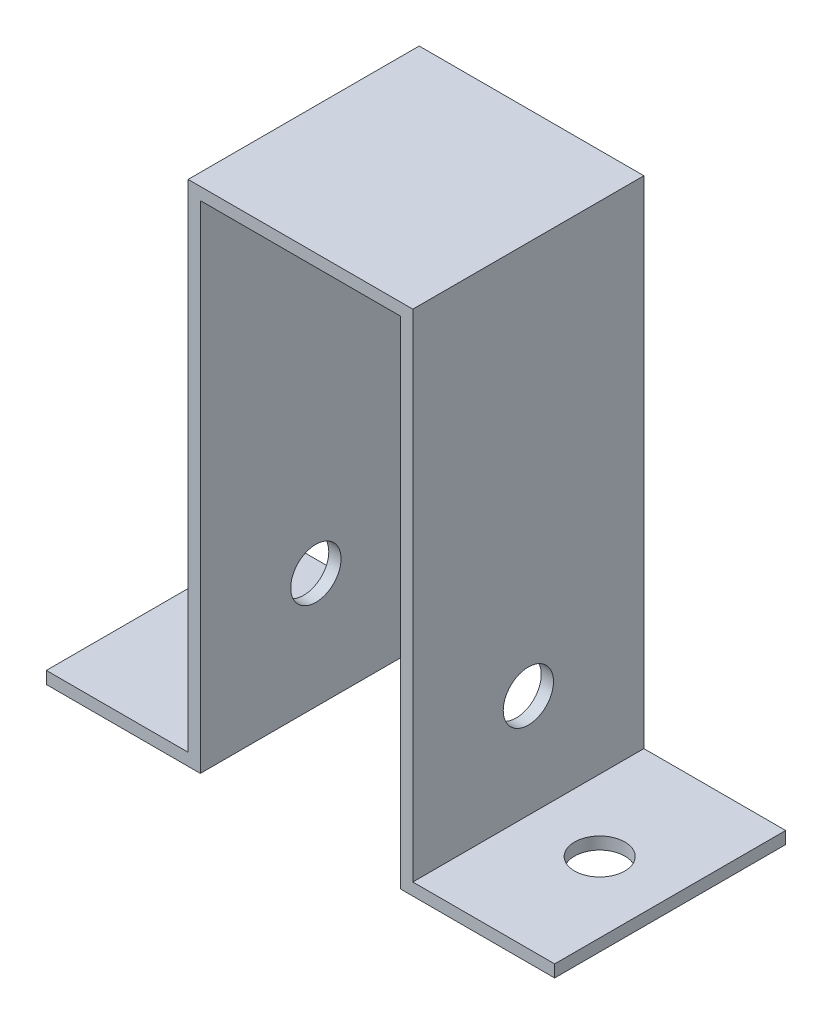
from build123d import *

# Parameters (mm, degrees)
BOSS_EXTRUDE1_DEPTH   = 7.5
F_4_CLEARANCE_HOLE1_D = 3.2639
F_4_CLEARANCE_HOLE2_D = 3.2639


with BuildPart() as part:
    # Sketch1 → Boss-Extrude1 (new, symmetric)
    with BuildSketch(Plane.XY):
        Polygon((0, 32.20625), (-6.5, 32.20625), (-6.5, 0), (-16.5, 0), (-16.5, 0.79375), (-7.29375, 0.79375), (-7.29375, 33), (0, 33), align=None)
    boss_extrude1 = extrude(amount=BOSS_EXTRUDE1_DEPTH, both=True)

    # #4 Clearance Hole1 (through all)
    with Locations(Plane(origin=(-6.5, 0, 0), x_dir=(0, 0, -1), z_dir=(1, 0, 0))):
        with Locations((0, 7.5)):
            f_4_clearance_hole1 = Hole(F_4_CLEARANCE_HOLE1_D / 2)

    # Mirror1: Boss-Extrude1, #4 Clearance Hole1 across plane
    add(boss_extrude1.mirror(Plane(origin=(0, 0, 0), x_dir=(0, 0, 1), z_dir=(1, 0, 0))))
    add(f_4_clearance_hole1.mirror(Plane(origin=(0, 0, 0), x_dir=(0, 0, 1), z_dir=(1, 0, 0))), mode=Mode.SUBTRACT)

    # #4 Clearance Hole2 (through all)
    with Locations(Plane(origin=(0, 0, 0), x_dir=(-1, 0, 0), z_dir=(0, -1, 0))):
        with Locations((11.925, 0), (-11.925, 0)):
            Hole(F_4_CLEARANCE_HOLE2_D / 2)


solid = part.part
